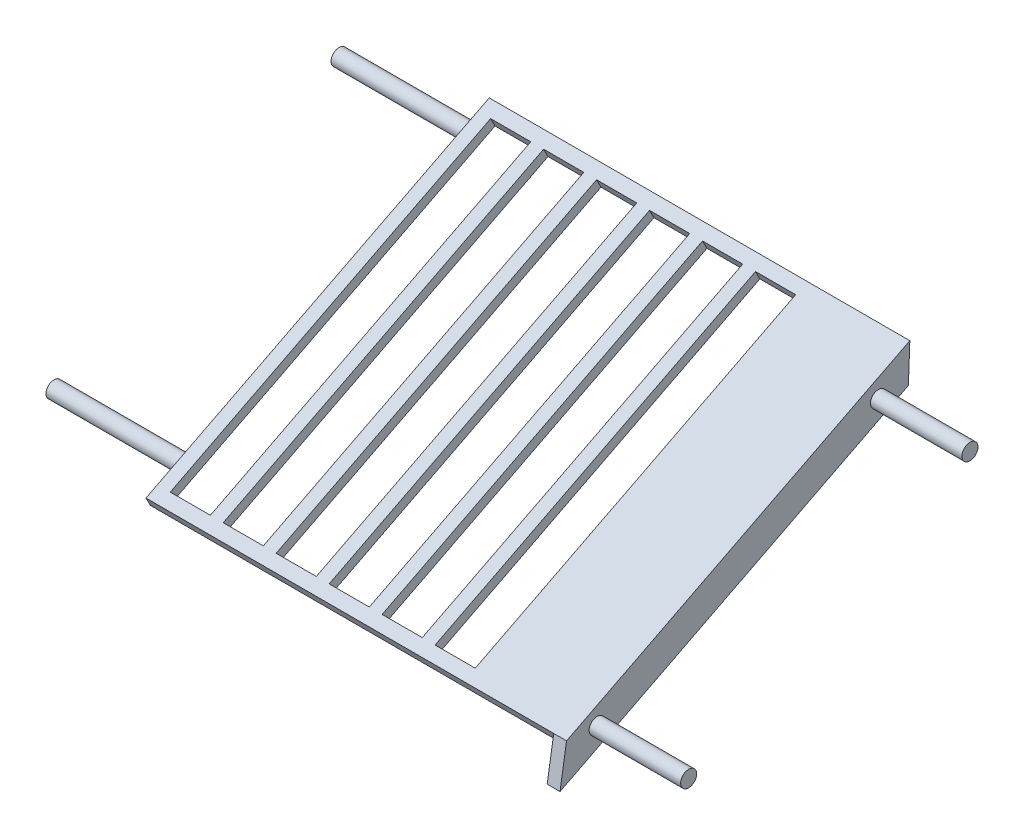
from build123d import *

# Parameters (mm, degrees)
SKETCH1_W               = 1200
SKETCH1_H               = 1500
BOSS_EXTRUDE1_DEPTH     = 160
BOSS_EXTRUDE2_DEPTH     = 1270
SKETCH3_W               = 125
SKETCH3_H               = 1120
CUT_EXTRUDE2_DEPTH      = 30
LPATTERN1_COUNT         = 6
LPATTERN1_PITCH         = 165
SKETCH4_W               = 125
SKETCH4_H               = 1120
CUT_EXTRUDE3_DEPTH      = 30
LPATTERN2_COUNT         = 6
LPATTERN2_PITCH         = 165
CUT_EXTRUDE5_DEPTH      = 70
CUT_EXTRUDE5_DEPTH_BACK = 3200
SKETCH5_W               = 160
SKETCH5_H               = 1200
BOSS_EXTRUDE3_DEPTH     = 40
CUT_EXTRUDE6_DEPTH      = 1622
SKETCH8_R               = 25
BOSS_EXTRUDE4_DEPTH     = 284.986135381
SKETCH10_R              = 25
BOSS_EXTRUDE5_DEPTH     = 408.541682101


with BuildPart() as part:
    # Sketch1 → Boss-Extrude1 (new body)
    with BuildSketch(Plane(origin=(0, 0, 0), x_dir=(0, 0, -1), z_dir=(1, 0, 0))):
        with Locations((564.361948956, -723.13225058)):
            Rectangle(SKETCH1_W, SKETCH1_H)
    extrude(amount=BOSS_EXTRUDE1_DEPTH)

    # Sketch2 → Boss-Extrude2 (add)
    with BuildSketch(Plane.ZY):
        Polygon((293.387128793, -77.723630642), (-775.820700233, 467.064969046), (-789.440415225, 440.33477332), (279.767413801, -104.453826367), align=None)
        Polygon((333.138052406, -383.823490794), (-736.06977662, -928.612090481), (-722.450061628, -955.342286207), (346.757767398, -410.553686519), align=None)
    extrude(amount=BOSS_EXTRUDE2_DEPTH)

    # Sketch3 → Cut-Extrude2 (cut)
    with BuildSketch(Plane(origin=(0, -466.202007743, 237.541787551), x_dir=(-1, 0, 0), z_dir=(0, -0.8910065241883673, 0.45399049973954775))):
        with Locations((1167.066310977, 477.424040248)):
            Rectangle(SKETCH3_W, SKETCH3_H)
    cut_extrude2 = extrude(amount=-CUT_EXTRUDE2_DEPTH, mode=Mode.SUBTRACT)

    # LPattern1: Cut-Extrude2 ×6
    with Locations(*[(i * LPATTERN1_PITCH, 0, 0) for i in range(1, LPATTERN1_COUNT)]):
        add(cut_extrude2, mode=Mode.SUBTRACT)

    # Sketch4 → Cut-Extrude3 (cut)
    with BuildSketch(Plane(origin=(0, 30.243173593, 15.409666619), x_dir=(-1, 0, 0), z_dir=(0, -0.891006524188367, -0.4539904997395487))):
        with Locations((1167.5, 303.304364216)):
            Rectangle(SKETCH4_W, SKETCH4_H)
    cut_extrude3 = extrude(amount=-CUT_EXTRUDE3_DEPTH, mode=Mode.SUBTRACT)

    # LPattern2: Cut-Extrude3 ×6
    with Locations(*[(i * LPATTERN2_PITCH, 0, 0) for i in range(1, LPATTERN2_COUNT)]):
        add(cut_extrude3, mode=Mode.SUBTRACT)

    # Sketch5 → Cut-Extrude5 (cut, two sides: drawn at the far end of the back side and taken through both)
    with BuildSketch(Plane(origin=(0, 26.86774942, 0), x_dir=(1, 0, 0), z_dir=(0, 1, 0)).offset(-CUT_EXTRUDE5_DEPTH_BACK)):
        with Locations((80, 564.361948956)):
            Rectangle(SKETCH5_W, SKETCH5_H)
    extrude(amount=CUT_EXTRUDE5_DEPTH + CUT_EXTRUDE5_DEPTH_BACK, mode=Mode.SUBTRACT)


with BuildPart() as cut_extrude5_piece_1:
    # of the separate pieces the step leaves, piece 1, a body of its own (cut_extrude5_pieces)
    add(part.part.solids().sort_by_distance((0, -104.453826367, 279.767413801))[0])



with BuildPart() as cut_extrude5_piece_2:
    # of the separate pieces the step leaves, piece 2, a body of its own (cut_extrude5_pieces)
    add(part.part.solids().sort_by_distance((0, -410.553686519, 346.757767398))[0])


with BuildPart() as cut_extrude5_piece_1_1:
    add(cut_extrude5_piece_1.part)

    add(cut_extrude5_piece_2.part)  # Boss-Extrude3 merges Cut-Extrude5 piece 2
    # Sketch6 → Boss-Extrude3 (add)
    with BuildSketch(Plane(origin=(0, 0, 0), x_dir=(0, 0, -1), z_dir=(1, 0, 0))):
        Polygon((-293.387128793, -77.723630642), (-346.757767398, -410.553686519), (722.450061628, -955.342286207), (775.820700233, 467.064969046), align=None)
    extrude(amount=BOSS_EXTRUDE3_DEPTH)

    # Sketch7 → Cut-Extrude6 (cut)
    with BuildSketch(Plane(origin=(40, 0, 0), x_dir=(0, 0, -1), z_dir=(1, 0, 0))):
        Polygon((779.00615654, 352.336895643), (771.36995873, 348.446058521), (722.450061628, -955.342286207), (-346.757767398, -410.553686519), (-313.704524727, -204.427005397), (-484.232359842, -291.315277235), (-228.557425004, -1565.861378417), (1566.457503136, -862.127788671), align=None)
        Polygon((771.36995873, 348.446058521), (-13.619714992, -51.52615783), (-313.704524727, -204.427005397), (-346.757767398, -410.553686519), (722.450061628, -955.342286207), align=None)
    extrude(amount=-CUT_EXTRUDE6_DEPTH, mode=Mode.SUBTRACT)

    # Sketch8 → Boss-Extrude4 (add)
    with BuildSketch(Plane(origin=(40, 0, 0), x_dir=(0, 0, -1), z_dir=(1, 0, 0))):
        with Locations(Location((-198.070529097, -84.596305771, 0), (0, 0, 180))):
            Circle(SKETCH8_R)
        with Locations(Location((678.163657159, 359.269351402, 0), (0, 0, 180))):
            Circle(SKETCH8_R)
    extrude(amount=BOSS_EXTRUDE4_DEPTH)

    # Sketch10 → Boss-Extrude5 (add)
    with BuildSketch(Plane.ZY.offset(1270)):
        with Locations(Location((-716.617969304, 403.229883829, 0), (0, 0, 153))):
            Circle(SKETCH10_R)
        with Locations(Location((171.176211965, -49.123845441, 0), (0, 0, 153))):
            Circle(SKETCH10_R)
    extrude(amount=BOSS_EXTRUDE5_DEPTH)


solid = cut_extrude5_piece_1_1.part
